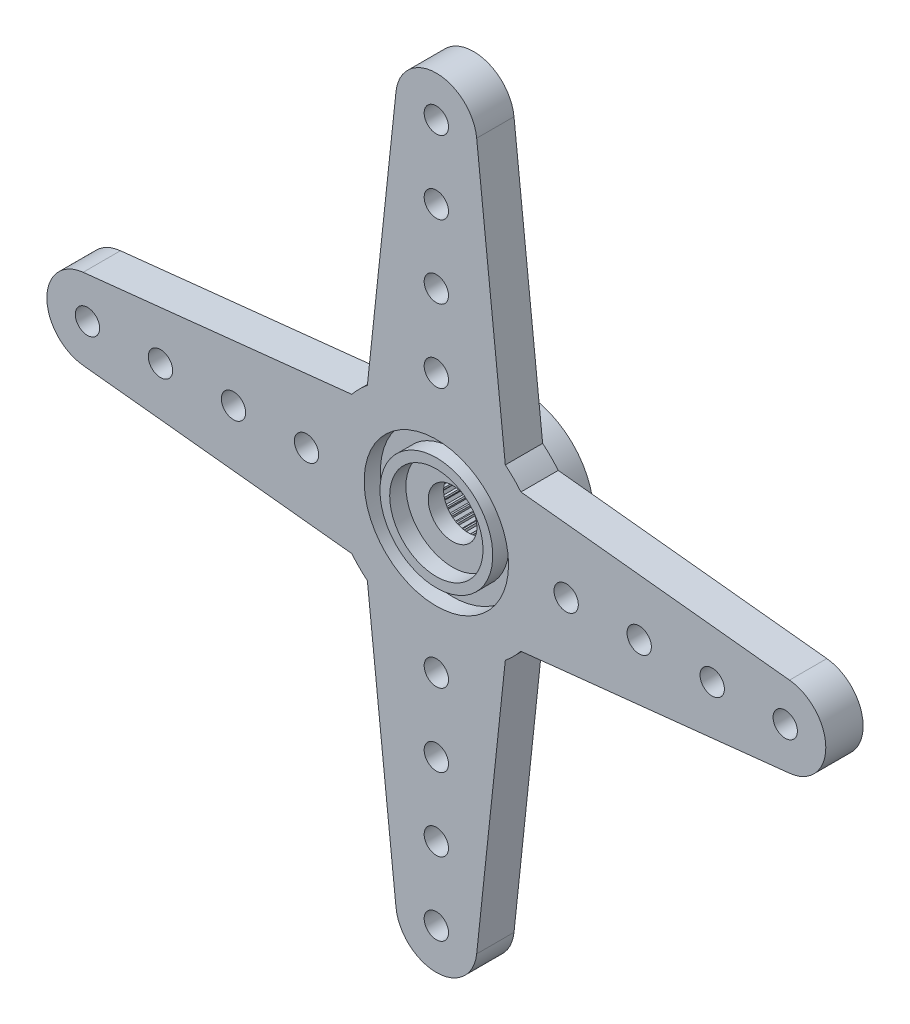
from build123d import *

# Parameters (mm, degrees)
BOSS_EXTRU_1_DEPTH      = 2.3
ESQUISSE2_R             = 4.45
ENL_V_MAT_EXTRU_1_DEPTH = 1
ESQUISSE3_R             = 3.475
ESQUISSE3_R_2           = 2.875
BOSS_EXTRU_2_DEPTH      = 1
ESQUISSE4_R             = 4.4
BOSS_EXTRU_3_DEPTH      = 3
ESQUISSE5_R             = 1.5
ENL_V_MAT_EXTRU_2_DEPTH = 35.212424644
ENL_V_START             = -3.35
ESQUISSE6_R             = 1.5
ENL_V_MAT_EXTRU_3_DEPTH = 3.35
ESQUISSE7_R             = 0.75
ENL_V_MAT_EXTRU_4_DEPTH = 3.35


with BuildPart() as part:
    # Esquisse1 → Boss.-Extru.1 (new body)
    with BuildSketch(Plane.XY):
        with BuildLine():
            Line((-21.76492676, 2.485923131), (-5.211825496, 4.25))
            ThreePointArc((-5.211825496, 4.25), (-4.755293103, 4.755293103), (-4.25, 5.211825496))
            Line((-4.25, 5.211825496), (-2.485923131, 21.76492676))
            ThreePointArc((-2.485923131, 21.76492676), (0, 24), (2.485923131, 21.76492676))
            Line((2.485923131, 21.76492676), (4.25, 5.211825496))
            ThreePointArc((4.25, 5.211825496), (4.755293103, 4.755293103), (5.211825496, 4.25))
            Line((5.211825496, 4.25), (21.76492676, 2.485923131))
            ThreePointArc((21.76492676, 2.485923131), (24, 0), (21.76492676, -2.485923131))
            Line((21.76492676, -2.485923131), (5.211825496, -4.25))
            ThreePointArc((5.211825496, -4.25), (4.755293103, -4.755293103), (4.25, -5.211825496))
            Line((4.25, -5.211825496), (2.485923131, -21.76492676))
            ThreePointArc((2.485923131, -21.76492676), (0, -24), (-2.485923131, -21.76492676))
            Line((-2.485923131, -21.76492676), (-4.25, -5.211825496))
            ThreePointArc((-4.25, -5.211825496), (-4.755293103, -4.755293103), (-5.211825496, -4.25))
            Line((-5.211825496, -4.25), (-21.76492676, -2.485923131))
            ThreePointArc((-21.76492676, -2.485923131), (-24, 0), (-21.76492676, 2.485923131))
        make_face()
    extrude(amount=BOSS_EXTRU_1_DEPTH)

    # Esquisse2 → Enlèv. mat.-Extru.1 (cut)
    with BuildSketch(Plane.XY.offset(2.3)):
        Circle(ESQUISSE2_R)
    extrude(amount=-ENL_V_MAT_EXTRU_1_DEPTH, mode=Mode.SUBTRACT)

    # Esquisse3 → Boss.-Extru.2 (add)
    with BuildSketch(Plane.XY.offset(1.3)):
        with Locations(Location((0, 0, 0), (0, 0, 180))):
            Circle(ESQUISSE3_R)
        with Locations(Location((0, 0, 0), (0, 0, 180))):
            Circle(ESQUISSE3_R_2, mode=Mode.SUBTRACT)
    extrude(amount=BOSS_EXTRU_2_DEPTH)

    # Esquisse4 → Boss.-Extru.3 (add)
    with BuildSketch(Plane(origin=(0, 0, 0), x_dir=(-1, 0, 0), z_dir=(0, 0, -1))):
        Circle(ESQUISSE4_R)
    extrude(amount=BOSS_EXTRU_3_DEPTH)

    # Esquisse5 → Enlèv. mat.-Extru.2 (cut, through all)
    with BuildSketch(Plane.XY.offset(1.3)):
        Circle(ESQUISSE5_R)
    extrude(amount=-ENL_V_MAT_EXTRU_2_DEPTH, mode=Mode.SUBTRACT)

    # Esquisse6 → Enlèv. mat.-Extru.3 (cut)
    with BuildSketch(Plane(origin=(0, 0, -3), x_dir=(-1, 0, 0), z_dir=(0, 0, -1)).offset(ENL_V_START)):
        with BuildLine():
            Line((-0.040605305, 2.865160176), (-0.114276657, 2.997822684))
            ThreePointArc((-0.114276657, 2.997822684), (-0.209269421, 2.992692151), (-0.304051754, 2.984552317))
            Line((-0.304051754, 2.984552317), (-0.35854309, 2.8429278))
            Line((-0.35854309, 2.8429278), (-0.438963363, 2.831625467))
            Line((-0.438963363, 2.831625467), (-0.530380804, 2.952743843))
            ThreePointArc((-0.530380804, 2.952743843), (-0.623735072, 2.934442802), (-0.716462144, 2.913191033))
            Line((-0.716462144, 2.913191033), (-0.750712851, 2.765361068))
            Line((-0.750712851, 2.765361068), (-0.828777499, 2.742976391))
            Line((-0.828777499, 2.742976391), (-0.936161691, 2.850193202))
            ThreePointArc((-0.936161691, 2.850193202), (-1.02606043, 2.819077862), (-1.114927414, 2.7851278))
            Line((-1.114927414, 2.7851278), (-1.12827084, 2.633969729))
            Line((-1.12827084, 2.633969729), (-1.202460424, 2.600938398))
            Line((-1.202460424, 2.600938398), (-1.323721256, 2.692166792))
            ThreePointArc((-1.323721256, 2.692166792), (-1.408414688, 2.648842779), (-1.491691889, 2.602855222))
            Line((-1.491691889, 2.602855222), (-1.483868321, 2.451311165))
            Line((-1.483868321, 2.451311165), (-1.552738824, 2.408276099))
            Line((-1.552738824, 2.408276099), (-1.685516093, 2.481740418))
            ThreePointArc((-1.685516093, 2.481740418), (-1.763355757, 2.427050983), (-1.839422279, 2.369921028))
            Line((-1.839422279, 2.369921028), (-1.810583992, 2.220940618))
            Line((-1.810583992, 2.220940618), (-1.872794929, 2.168739444))
            Line((-1.872794929, 2.168739444), (-2.014504276, 2.223009789))
            ThreePointArc((-2.014504276, 2.223009789), (-2.083975111, 2.158019401), (-2.151350406, 2.090859017))
            Line((-2.151350406, 2.090859017), (-2.102058706, 1.947341988))
            Line((-2.102058706, 1.947341988), (-2.156399211, 1.886990743))
            Line((-2.156399211, 1.886990743), (-2.304282424, 1.921010804))
            ThreePointArc((-2.304282424, 1.921010804), (-2.364032261, 1.846984426), (-2.421404945, 1.771100813))
            Line((-2.421404945, 1.771100813), (-2.352619239, 1.635840561))
            Line((-2.352619239, 1.635840561), (-2.398031635, 1.568513914))
            Line((-2.398031635, 1.568513914), (-2.549210337, 1.581621528))
            ThreePointArc((-2.549210337, 1.581621528), (-2.598076211, 1.5), (-2.644329591, 1.416870147))
            Line((-2.644329591, 1.416870147), (-2.557388713, 1.292499358))
            Line((-2.557388713, 1.292499358), (-2.592989102, 1.219507746))
            Line((-2.592989102, 1.219507746), (-2.74452077, 1.211447789))
            ThreePointArc((-2.74452077, 1.211447789), (-2.781551564, 1.12381978), (-2.815785369, 1.035061715))
            Line((-2.815785369, 1.035061715), (-2.712381526, 0.924001126))
            Line((-2.712381526, 0.924001126), (-2.737476984, 0.846765246))
            Line((-2.737476984, 0.846765246), (-2.886412228, 0.817694596))
            ThreePointArc((-2.886412228, 0.817694596), (-2.910887179, 0.725765687), (-2.932435088, 0.633106984))
            Line((-2.932435088, 0.633106984), (-2.814580917, 0.537518262))
            Line((-2.814580917, 0.537518262), (-2.828682992, 0.457541424))
            Line((-2.828682992, 0.457541424), (-2.972122955, 0.408025908))
            ThreePointArc((-2.972122955, 0.408025908), (-2.983565686, 0.31358539), (-2.992008294, 0.218829546))
            Line((-2.992008294, 0.218829546), (-2.861997693, 0.140573217))
            Line((-2.861997693, 0.140573217), (-2.864831902, 0.059412079))
            Line((-2.864831902, 0.059412079), (-2.999984689, -0.00958454))
            ThreePointArc((-2.999984689, -0.00958454), (-2.998172481, -0.10469849), (-2.993345461, -0.19970716))
            Line((-2.993345461, -0.19970716), (-2.853708938, -0.259107925))
            Line((-2.853708938, -0.259107925), (-2.845220118, -0.339873655))
            Line((-2.845220118, -0.339873655), (-2.969455134, -0.427008436))
            ThreePointArc((-2.969455134, -0.427008436), (-2.954423259, -0.520944533), (-2.936420564, -0.614356794))
            Line((-2.936420564, -0.614356794), (-2.789875986, -0.653745827))
            Line((-2.789875986, -0.653745827), (-2.770229361, -0.732544135))
            Line((-2.770229361, -0.732544135), (-2.881128513, -0.836121099))
            ThreePointArc((-2.881128513, -0.836121099), (-2.853169549, -0.927050983), (-2.822341581, -1.017048672))
            Line((-2.822341581, -1.017048672), (-2.67174127, -1.03565931))
            Line((-2.67174127, -1.03565931), (-2.641319241, -1.110956476))
            Line((-2.641319241, -1.110956476), (-2.736724002, -1.228959615))
            ThreePointArc((-2.736724002, -1.228959615), (-2.696382139, -1.31511344), (-2.653328929, -1.399944854))
            Line((-2.653328929, -1.399944854), (-2.50160415, -1.397414862))
            Line((-2.50160415, -1.397414862), (-2.460998845, -1.467745313))
            Line((-2.460998845, -1.467745313), (-2.539052272, -1.59787783))
            ThreePointArc((-2.539052272, -1.59787783), (-2.487112718, -1.67757871), (-2.432672248, -1.755592702))
            Line((-2.432672248, -1.755592702), (-2.282776151, -1.731971324))
            Line((-2.282776151, -1.731971324), (-2.232777907, -1.795966158))
            Line((-2.232777907, -1.795966158), (-2.291960777, -1.935695171))
            ThreePointArc((-2.291960777, -1.935695171), (-2.229434476, -2.007391819), (-2.164666369, -2.077069935))
            Line((-2.164666369, -2.077069935), (-2.019516511, -2.032816934))
            Line((-2.019516511, -2.032816934), (-1.961098487, -2.089230564))
            Line((-1.961098487, -2.089230564), (-2.000258873, -2.235836408))
            ThreePointArc((-2.000258873, -2.235836408), (-1.928362829, -2.298133329), (-1.854527721, -2.358119364))
            Line((-1.854527721, -2.358119364), (-1.716949278, -2.294096074))
            Line((-1.716949278, -2.294096074), (-1.651248515, -2.341830473))
            Line((-1.651248515, -2.341830473), (-1.669624205, -2.492459631))
            ThreePointArc((-1.669624205, -2.492459631), (-1.589757793, -2.544144288), (-1.5082928, -2.593270682))
            Line((-1.5082928, -2.593270682), (-1.380963581, -2.510723244))
            Line((-1.380963581, -2.510723244), (-1.309258869, -2.548849316))
            Line((-1.309258869, -2.548849316), (-1.306492201, -2.700569964))
            ThreePointArc((-1.306492201, -2.700569964), (-1.220209929, -2.740636373), (-1.132700676, -2.777946936))
            Line((-1.132700676, -2.777946936), (-1.018098999, -2.678482042))
            Line((-1.018098999, -2.678482042), (-0.941785989, -2.706257707))
            Line((-0.941785989, -2.706257707), (-0.917930812, -2.856116773))
            ThreePointArc((-0.917930812, -2.856116773), (-0.826912067, -2.883785088), (-0.735061821, -2.908553613))
            Line((-0.735061821, -2.908553613), (-0.635418278, -2.794107234))
            Line((-0.635418278, -2.794107234), (-0.555982315, -2.810991869))
            Line((-0.555982315, -2.810991869), (-0.511502945, -2.956072519))
            ThreePointArc((-0.511502945, -2.956072519), (-0.417519303, -2.970804206), (-0.323115824, -2.982548602))
            Line((-0.323115824, -2.982548602), (-0.240369863, -2.855348306))
            Line((-0.240369863, -2.855348306), (-0.159357078, -2.861013272))
            Line((-0.159357078, -2.861013272), (-0.095119254, -2.998491675))
            ThreePointArc((-0.095119254, -2.998491675), (0, -3), (0.095119254, -2.998491675))
            Line((0.095119254, -2.998491675), (0.159357078, -2.861013272))
            Line((0.159357078, -2.861013272), (0.240369863, -2.855348306))
            Line((0.240369863, -2.855348306), (0.323115824, -2.982548602))
            ThreePointArc((0.323115824, -2.982548602), (0.417519303, -2.970804206), (0.511502945, -2.956072519))
            Line((0.511502945, -2.956072519), (0.555982315, -2.810991869))
            Line((0.555982315, -2.810991869), (0.635418278, -2.794107234))
            Line((0.635418278, -2.794107234), (0.735061821, -2.908553613))
            ThreePointArc((0.735061821, -2.908553613), (0.826912067, -2.883785088), (0.917930812, -2.856116773))
            Line((0.917930812, -2.856116773), (0.941785989, -2.706257707))
            Line((0.941785989, -2.706257707), (1.018098999, -2.678482042))
            Line((1.018098999, -2.678482042), (1.132700676, -2.777946936))
            ThreePointArc((1.132700676, -2.777946936), (1.220209929, -2.740636373), (1.306492201, -2.700569964))
            Line((1.306492201, -2.700569964), (1.309258869, -2.548849316))
            Line((1.309258869, -2.548849316), (1.380963581, -2.510723244))
            Line((1.380963581, -2.510723244), (1.5082928, -2.593270682))
            ThreePointArc((1.5082928, -2.593270682), (1.589757793, -2.544144288), (1.669624205, -2.492459631))
            Line((1.669624205, -2.492459631), (1.651248515, -2.341830473))
            Line((1.651248515, -2.341830473), (1.716949278, -2.294096074))
            Line((1.716949278, -2.294096074), (1.854527721, -2.358119364))
            ThreePointArc((1.854527721, -2.358119364), (1.928362829, -2.298133329), (2.000258873, -2.235836408))
            Line((2.000258873, -2.235836408), (1.961098487, -2.089230564))
            Line((1.961098487, -2.089230564), (2.019516511, -2.032816934))
            Line((2.019516511, -2.032816934), (2.164666369, -2.077069935))
            ThreePointArc((2.164666369, -2.077069935), (2.229434476, -2.007391819), (2.291960777, -1.935695171))
            Line((2.291960777, -1.935695171), (2.232777907, -1.795966158))
            Line((2.232777907, -1.795966158), (2.282776151, -1.731971324))
            Line((2.282776151, -1.731971324), (2.432672248, -1.755592702))
            ThreePointArc((2.432672248, -1.755592702), (2.487112718, -1.67757871), (2.539052272, -1.59787783))
            Line((2.539052272, -1.59787783), (2.460998845, -1.467745313))
            Line((2.460998845, -1.467745313), (2.50160415, -1.397414862))
            Line((2.50160415, -1.397414862), (2.653328929, -1.399944854))
            ThreePointArc((2.653328929, -1.399944854), (2.696382139, -1.31511344), (2.736724002, -1.228959615))
            Line((2.736724002, -1.228959615), (2.641319241, -1.110956476))
            Line((2.641319241, -1.110956476), (2.67174127, -1.03565931))
            Line((2.67174127, -1.03565931), (2.822341581, -1.017048672))
            ThreePointArc((2.822341581, -1.017048672), (2.853169549, -0.927050983), (2.881128513, -0.836121099))
            Line((2.881128513, -0.836121099), (2.770229361, -0.732544135))
            Line((2.770229361, -0.732544135), (2.789875986, -0.653745827))
            Line((2.789875986, -0.653745827), (2.936420564, -0.614356794))
            ThreePointArc((2.936420564, -0.614356794), (2.954423259, -0.520944533), (2.969455134, -0.427008436))
            Line((2.969455134, -0.427008436), (2.845220118, -0.339873655))
            Line((2.845220118, -0.339873655), (2.853708938, -0.259107925))
            Line((2.853708938, -0.259107925), (2.993345461, -0.19970716))
            ThreePointArc((2.993345461, -0.19970716), (2.998172481, -0.10469849), (2.999984689, -0.00958454))
            Line((2.999984689, -0.00958454), (2.864831902, 0.059412079))
            Line((2.864831902, 0.059412079), (2.861997693, 0.140573217))
            Line((2.861997693, 0.140573217), (2.992008294, 0.218829546))
            ThreePointArc((2.992008294, 0.218829546), (2.983565686, 0.31358539), (2.972122955, 0.408025908))
            Line((2.972122955, 0.408025908), (2.828682992, 0.457541424))
            Line((2.828682992, 0.457541424), (2.814580917, 0.537518262))
            Line((2.814580917, 0.537518262), (2.932435088, 0.633106984))
            ThreePointArc((2.932435088, 0.633106984), (2.910887179, 0.725765687), (2.886412228, 0.817694596))
            Line((2.886412228, 0.817694596), (2.737476984, 0.846765246))
            Line((2.737476984, 0.846765246), (2.712381526, 0.924001126))
            Line((2.712381526, 0.924001126), (2.815785369, 1.035061715))
            ThreePointArc((2.815785369, 1.035061715), (2.781551564, 1.12381978), (2.74452077, 1.211447789))
            Line((2.74452077, 1.211447789), (2.592989102, 1.219507746))
            Line((2.592989102, 1.219507746), (2.557388713, 1.292499358))
            Line((2.557388713, 1.292499358), (2.644329591, 1.416870147))
            ThreePointArc((2.644329591, 1.416870147), (2.598076211, 1.5), (2.549210337, 1.581621528))
            Line((2.549210337, 1.581621528), (2.398031635, 1.568513914))
            Line((2.398031635, 1.568513914), (2.352619239, 1.635840561))
            Line((2.352619239, 1.635840561), (2.421404945, 1.771100813))
            ThreePointArc((2.421404945, 1.771100813), (2.364032261, 1.846984426), (2.304282424, 1.921010804))
            Line((2.304282424, 1.921010804), (2.156399211, 1.886990743))
            Line((2.156399211, 1.886990743), (2.102058706, 1.947341988))
            Line((2.102058706, 1.947341988), (2.151350406, 2.090859017))
            ThreePointArc((2.151350406, 2.090859017), (2.083975111, 2.158019401), (2.014504276, 2.223009789))
            Line((2.014504276, 2.223009789), (1.872794929, 2.168739444))
            Line((1.872794929, 2.168739444), (1.810583992, 2.220940618))
            Line((1.810583992, 2.220940618), (1.839422279, 2.369921028))
            ThreePointArc((1.839422279, 2.369921028), (1.763355757, 2.427050983), (1.685516093, 2.481740418))
            Line((1.685516093, 2.481740418), (1.552738824, 2.408276099))
            Line((1.552738824, 2.408276099), (1.483868321, 2.451311165))
            Line((1.483868321, 2.451311165), (1.491691889, 2.602855222))
            ThreePointArc((1.491691889, 2.602855222), (1.408414688, 2.648842779), (1.323721256, 2.692166792))
            Line((1.323721256, 2.692166792), (1.202460424, 2.600938398))
            Line((1.202460424, 2.600938398), (1.12827084, 2.633969729))
            Line((1.12827084, 2.633969729), (1.114927414, 2.7851278))
            ThreePointArc((1.114927414, 2.7851278), (1.02606043, 2.819077862), (0.936161691, 2.850193202))
            Line((0.936161691, 2.850193202), (0.828777499, 2.742976391))
            Line((0.828777499, 2.742976391), (0.750712851, 2.765361068))
            Line((0.750712851, 2.765361068), (0.716462144, 2.913191033))
            ThreePointArc((0.716462144, 2.913191033), (0.623735072, 2.934442802), (0.530380804, 2.952743843))
            Line((0.530380804, 2.952743843), (0.438963363, 2.831625467))
            Line((0.438963363, 2.831625467), (0.35854309, 2.8429278))
            Line((0.35854309, 2.8429278), (0.304051754, 2.984552317))
            ThreePointArc((0.304051754, 2.984552317), (0.209269421, 2.992692151), (0.114276657, 2.997822684))
            Line((0.114276657, 2.997822684), (0.040605305, 2.865160176))
            Line((0.040605305, 2.865160176), (-0.040605305, 2.865160176))
        make_face()
        with Locations(Location((0, 0, 0), (0, 0, 180))):
            Circle(ESQUISSE6_R, mode=Mode.SUBTRACT)
    extrude(amount=ENL_V_MAT_EXTRU_3_DEPTH, mode=Mode.SUBTRACT)

    # Esquisse7 → Enlèv. mat.-Extru.4 (cut)
    with BuildSketch(Plane.XY.offset(2.3)):
        with Locations((-21.5, 0)):
            Circle(ESQUISSE7_R)
        with Locations((0, 21.5)):
            Circle(ESQUISSE7_R)
        with Locations((0, 17)):
            Circle(ESQUISSE7_R)
        with Locations((-17, 0)):
            Circle(ESQUISSE7_R)
        with Locations((-12.5, 0)):
            Circle(ESQUISSE7_R)
        with Locations((-8, 0)):
            Circle(ESQUISSE7_R)
        with Locations(Location((8, 0, 0), (0, 0, 180))):
            Circle(ESQUISSE7_R)
        with Locations(Location((12.5, 0, 0), (0, 0, 180))):
            Circle(ESQUISSE7_R)
        with Locations(Location((17, 0, 0), (0, 0, 180))):
            Circle(ESQUISSE7_R)
        with Locations(Location((21.5, 0, 0), (0, 0, 180))):
            Circle(ESQUISSE7_R)
        with Locations((0, 12.5)):
            Circle(ESQUISSE7_R)
        with Locations((0, 8)):
            Circle(ESQUISSE7_R)
        with Locations(Location((0, -8, 0), (0, 0, 180))):
            Circle(ESQUISSE7_R)
        with Locations(Location((0, -12.5, 0), (0, 0, 180))):
            Circle(ESQUISSE7_R)
        with Locations(Location((0, -17, 0), (0, 0, 180))):
            Circle(ESQUISSE7_R)
        with Locations(Location((0, -21.5, 0), (0, 0, 180))):
            Circle(ESQUISSE7_R)
    extrude(amount=-ENL_V_MAT_EXTRU_4_DEPTH, mode=Mode.SUBTRACT)


solid = part.part
